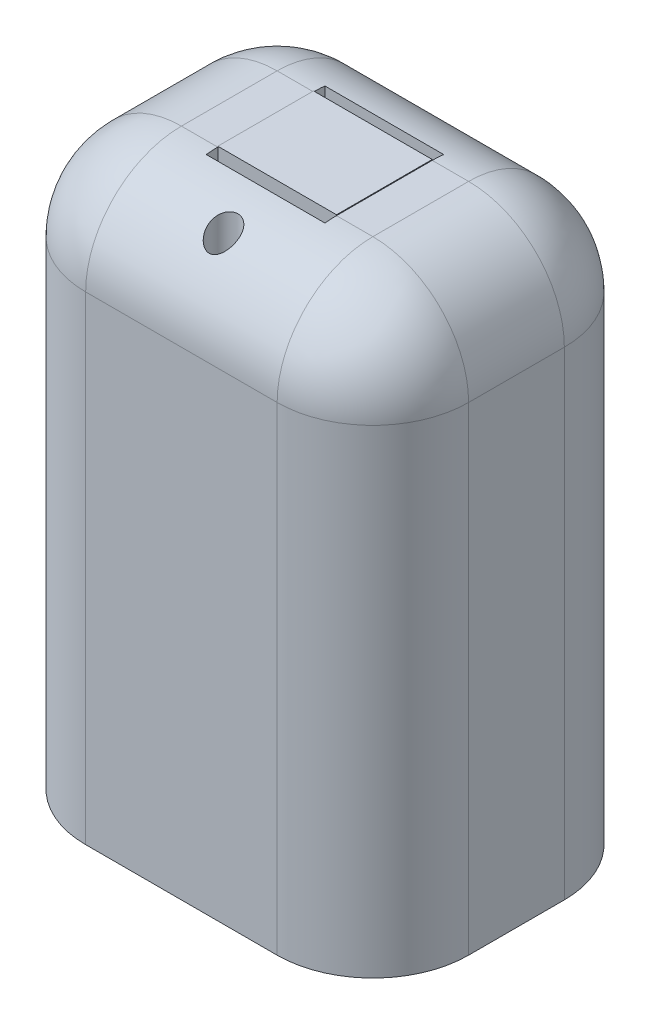
from build123d import *

# Parameters (mm, degrees)
SKETCH1_W           = 20
SKETCH1_H           = 30
BOSS_EXTRUDE1_DEPTH = 15
SKETCH2_W           = 6.2
SKETCH2_H           = 6.2
CUT_EXTRUDE1_DEPTH  = 3.25
FILLET1_R           = 5
SKETCH4_W           = 6.2
SKETCH4_H           = 6.2
CUT_EXTRUDE2_DEPTH  = 68
SKETCH6_W           = 5
SKETCH6_H           = 1
BOSS_EXTRUDE3_DEPTH = 6.2
SKETCH7_R           = 0.75
CUT_EXTRUDE3_DEPTH  = 37


with BuildPart() as part:
    # Sketch1 → Boss-Extrude1 (new body)
    with BuildSketch(Plane.XY):
        with Locations((-36.265495527, 120.408164147)):
            Rectangle(SKETCH1_W, SKETCH1_H)
    extrude(amount=BOSS_EXTRUDE1_DEPTH)

    # Sketch2 → Cut-Extrude1 (cut)
    with BuildSketch(Plane(origin=(0, 105.408164147, 0), x_dir=(-1, 0, 0), z_dir=(0, -1, 0))):
        with Locations((36.265495527, -7.5)):
            Rectangle(SKETCH2_W, SKETCH2_H)
    extrude(amount=-CUT_EXTRUDE1_DEPTH, mode=Mode.SUBTRACT)

    # Fillet1
    fillet1_edges = [part.edges().sort_by_distance(p)[0] for p in [
        (-46.265495527, 120.408164147, 15),
        (-26.265495527, 120.408164147, 15),
        (-46.265495527, 120.408164147, 0),
        (-36.265495527, 135.408164147, 0),
        (-26.265495527, 120.408164147, 0),
        (-36.265495527, 135.408164147, 15),
        (-46.265495527, 135.408164147, 7.5),
        (-26.265495527, 135.408164147, 7.5),
    ]]
    fillet(fillet1_edges, radius=FILLET1_R)

    # Sketch4 → Cut-Extrude2 (cut)
    with BuildSketch(Plane.XZ.offset(-108.658164147)):
        with Locations((-36.265495527, 7.5)):
            Rectangle(SKETCH4_W, SKETCH4_H)
    extrude(amount=-CUT_EXTRUDE2_DEPTH, mode=Mode.SUBTRACT)

    # Sketch6 → Boss-Extrude3 (add)
    with BuildSketch(Plane(origin=(-39.365495527, 0, 0), x_dir=(0, 0, -1), z_dir=(1, 0, 0))):
        with Locations((-7.5, 134.949726458)):
            Rectangle(SKETCH6_W, SKETCH6_H)
    extrude(amount=BOSS_EXTRUDE3_DEPTH)

    # Sketch7 → Cut-Extrude3 (cut)
    with BuildSketch(Plane.XZ.offset(-105.408164147)):
        with Locations(Location((-36.265495527, 12.8, 0), (0, 0, 270))):
            Circle(SKETCH7_R)
    extrude(amount=-CUT_EXTRUDE3_DEPTH, mode=Mode.SUBTRACT)


solid = part.part
